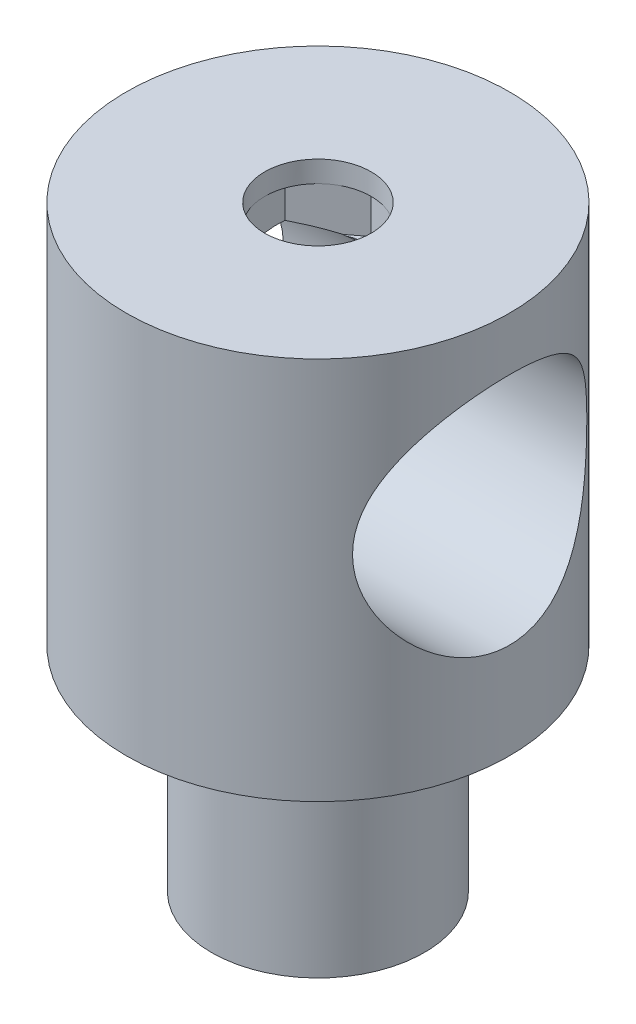
from build123d import *

# Parameters (mm, degrees)
SKETCH1_R               = 9
BOSS_EXTRUDE1_DEPTH     = 18
CUT_EXTRUDE1_DEPTH      = 23.045407685
CUT_EXTRUDE1_DEPTH_BACK = 23.045407685
SKETCH4_R               = 5.5
SKETCH2_R               = 2.5
CUT_EXTRUDE2_DEPTH      = 5
CUT_EXTRUDE6_START      = -1
CUT_EXTRUDE6_DEPTH      = 2
SKETCH8_R               = 5
BOSS_EXTRUDE2_DEPTH     = 10


with BuildPart() as part:
    # Sketch1 → Boss-Extrude1 (new body)
    with BuildSketch(Plane(origin=(0, 0, 0), x_dir=(1, 0, 0), z_dir=(0, 1, 0))):
        with Locations(Location((0, 0, 0), (0, 0, 270))):
            Circle(SKETCH1_R)
    extrude(amount=BOSS_EXTRUDE1_DEPTH)

    # Sketch4 → Cut-Extrude1 (cut, two sides: drawn at the far end of the back side and taken through both)
    with BuildSketch(Plane(origin=(0, 0, 0), x_dir=(0, 0, -1), z_dir=(1, 0, 0)).offset(-CUT_EXTRUDE1_DEPTH_BACK)):
        with Locations((0, 10)):
            Circle(SKETCH4_R)
    extrude(amount=CUT_EXTRUDE1_DEPTH + CUT_EXTRUDE1_DEPTH_BACK, mode=Mode.SUBTRACT)

    # Sketch2 → Cut-Extrude2 (cut)
    with BuildSketch(Plane(origin=(0, 18, 0), x_dir=(1, 0, 0), z_dir=(0, 1, 0))):
        with Locations(Location((0, 0, 0), (0, 0, 270))):
            Circle(SKETCH2_R)
    extrude(amount=-CUT_EXTRUDE2_DEPTH, mode=Mode.SUBTRACT)

    # Sketch7 → Cut-Extrude6 (cut)
    with BuildSketch(Plane(origin=(0, 18, 0), x_dir=(1, 0, 0), z_dir=(0, 1, 0)).offset(CUT_EXTRUDE6_START)):
        Polygon((-2.299117574, -1.74567801), (0.362242716, -2.86393323), (2.66136029, -1.118255221), (2.299117574, 1.74567801), (-0.362242716, 2.86393323), (-2.66136029, 1.118255221), align=None)
    extrude(amount=-CUT_EXTRUDE6_DEPTH, mode=Mode.SUBTRACT)

    # Sketch8 → Boss-Extrude2 (add)
    with BuildSketch(Plane.XZ):
        with Locations(Location((0, 0, 0), (0, 0, 270))):
            Circle(SKETCH8_R)
    extrude(amount=BOSS_EXTRUDE2_DEPTH)


solid = part.part
